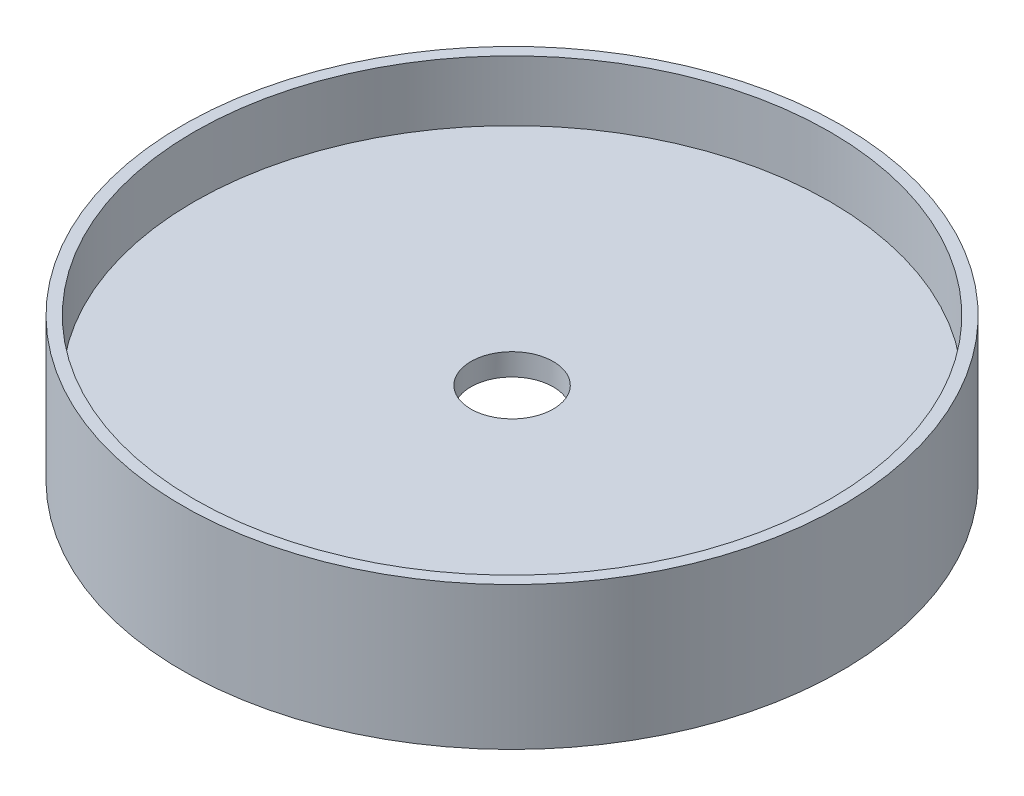
from build123d import *

# Parameters (mm, degrees)
SKETCH2_R          = 37.5
CUT_EXTRUDE1_DEPTH = 431.84219849


with BuildPart() as part:
    # Sketch1 → Revolve1 (revolve)
    with BuildSketch(Plane.XY, mode=Mode.PRIVATE) as revolve1_sk:
        Polygon((289.5, 20), (289.5, 75), (300, 75), (300, -55), (289.5, -55), (289.5, 0), (0, 0), (0, 20), align=None)
    revolve(revolve1_sk.sketch.rotate(Axis((0, 0, 0), (0, 1, 0)), 90), axis=Axis((0, 0, 0), (0, 1, 0)))

    # Sketch2 → Cut-Extrude1 (cut, through all)
    with BuildSketch(Plane(origin=(0, 20, 0), x_dir=(1, 0, 0), z_dir=(0, 1, 0))):
        with Locations(Location((0, 0, 0), (0, 0, 270))):
            Circle(SKETCH2_R)
    extrude(amount=-CUT_EXTRUDE1_DEPTH, mode=Mode.SUBTRACT)


solid = part.part
